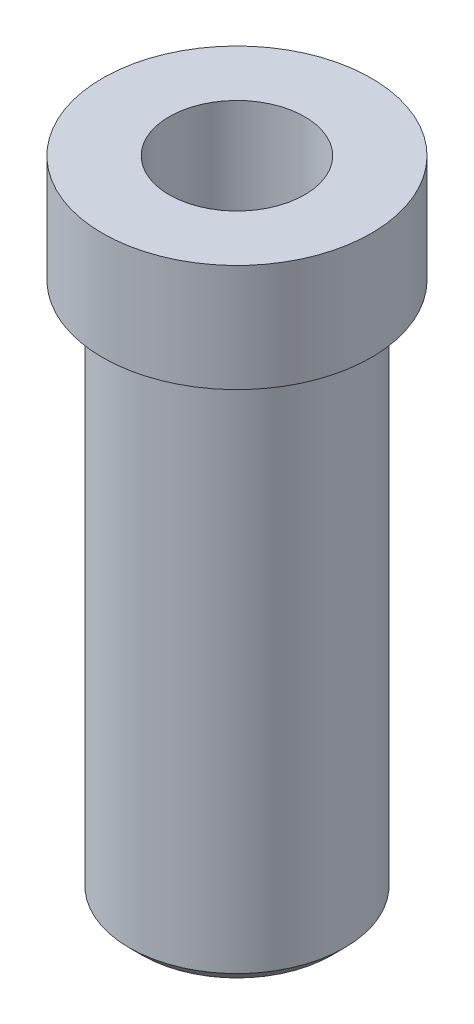
from build123d import *

# Parameters (mm, degrees)
SKETCH1_R              = 0.5
BOSS_EXTRUDE1_DEPTH    = 2.5
SKETCH2_R              = 0.625
BOSS_EXTRUDE2_DEPTH    = 0.5
F_12_0MM_DOWEL_HOLE1_D = 0.63
CHAMFER1_SIZE          = 0.06


with BuildPart() as part:
    # Sketch1 → Boss-Extrude1 (new body)
    with BuildSketch(Plane(origin=(0, 0, 0), x_dir=(1, 0, 0), z_dir=(0, 1, 0))):
        with Locations(Location((0, 0, 0), (0, 0, 270))):
            Circle(SKETCH1_R)
    extrude(amount=BOSS_EXTRUDE1_DEPTH)

    # Sketch2 → Boss-Extrude2 (add)
    with BuildSketch(Plane(origin=(0, 2.5, 0), x_dir=(1, 0, 0), z_dir=(0, 1, 0))):
        with Locations(Location((0, 0, 0), (0, 0, 270))):
            Circle(SKETCH2_R)
    extrude(amount=BOSS_EXTRUDE2_DEPTH)

    # Ø12.0mm Dowel Hole1 (through all)
    with Locations(Plane(origin=(0, 3, 0), x_dir=(1, 0, 0), z_dir=(0, 1, 0))):
        with Locations((0, 0)):
            Hole(F_12_0MM_DOWEL_HOLE1_D / 2)

    # Chamfer1
    chamfer1_edges = [part.edges().sort_by_distance(p)[0] for p in [
        (0, 0, -0.5),
    ]]
    chamfer(chamfer1_edges, length=CHAMFER1_SIZE)


solid = part.part
